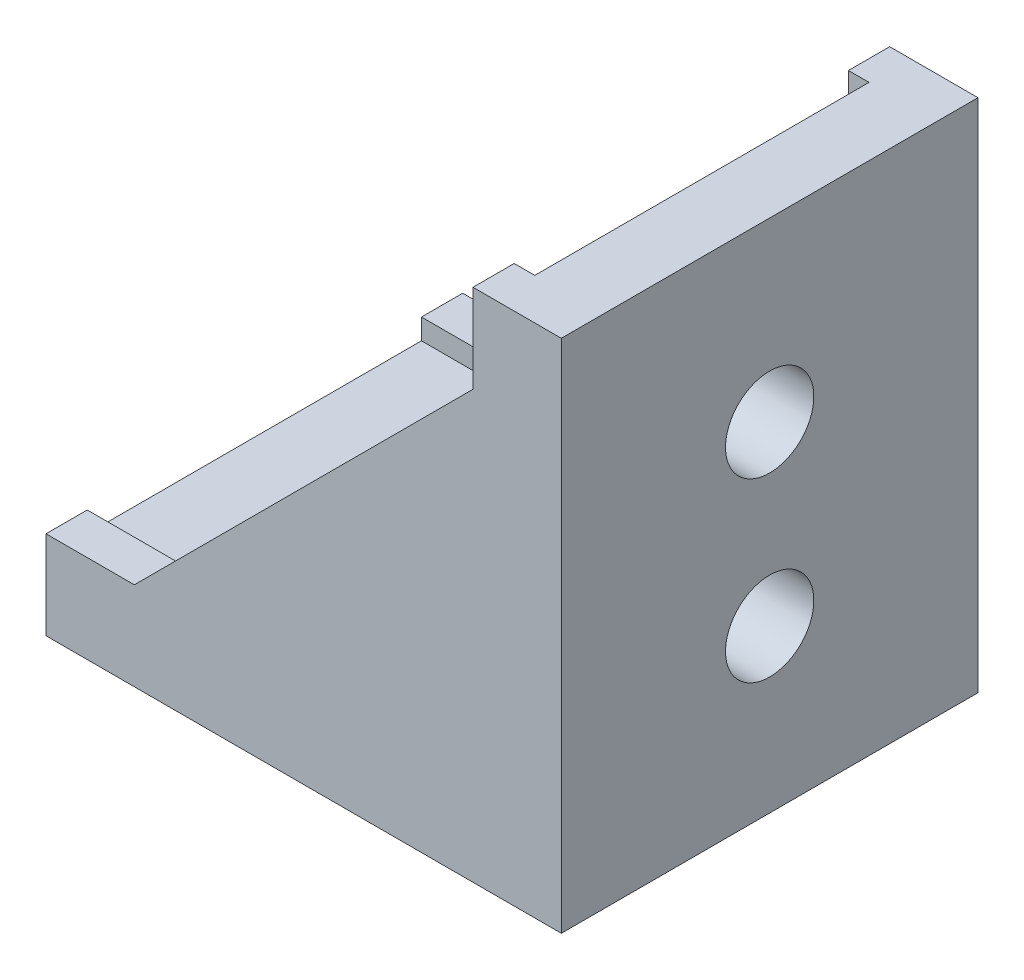
from build123d import *

# Parameters (mm, degrees)
EXTRUDE_1_DEPTH     = 14.15
SKETCH_2_W          = 30.4
SKETCH_2_H          = 30.4
CUT_EXTRUDE_1_DEPTH = 11.35
CUT_EXTRUDE_2_REACH = 53.48
SKETCH_4_R          = 3
CUT_EXTRUDE_3_REACH = 53.48
SKETCH_5_R          = 3


with BuildPart() as part:
    # 草图1 → 凸台-拉伸1 (new, symmetric)
    with BuildSketch(Plane.XY):
        Polygon((0, 0), (35, 0), (35, 35), (29, 35), (29, 29), (6, 6), (0, 6), align=None)
    extrude(amount=EXTRUDE_1_DEPTH, both=True)

    # 草图2 → 切除-拉伸1 (cut, symmetric)
    with BuildSketch(Plane.XY):
        with Locations((15.2, 19.8)):
            Rectangle(SKETCH_2_W, SKETCH_2_H)
    extrude(amount=CUT_EXTRUDE_1_DEPTH, both=True, mode=Mode.SUBTRACT)

    # 草图4 → 切除-拉伸2 (cut, up to next)
    with BuildSketch(Plane(origin=(0, 0, 0), x_dir=(1, 0, 0), z_dir=(0, 1, 0)), mode=Mode.PRIVATE) as cut_extrude_2_sk1:
        with Locations(Location((23, 0, 0), (0, 0, 270))):
            Circle(SKETCH_4_R)
    cut_extrude_2_tool1 = extrude(cut_extrude_2_sk1.sketch, amount=CUT_EXTRUDE_2_REACH, mode=Mode.PRIVATE) & part.part
    # 草图4 → 切除-拉伸2 (cut, up to next)
    with BuildSketch(Plane(origin=(0, 0, 0), x_dir=(1, 0, 0), z_dir=(0, 1, 0)), mode=Mode.PRIVATE) as cut_extrude_2_sk2:
        with Locations(Location((11, 0, 0), (0, 0, 270))):
            Circle(SKETCH_4_R)
    cut_extrude_2_tool2 = extrude(cut_extrude_2_sk2.sketch, amount=CUT_EXTRUDE_2_REACH, mode=Mode.PRIVATE) & part.part
    add(cut_extrude_2_tool1.solids().sort_by_distance((23, 0, 0))[0], mode=Mode.SUBTRACT)
    add(cut_extrude_2_tool2.solids().sort_by_distance((11, 0, 0))[0], mode=Mode.SUBTRACT)

    # 草图5 → 切除-拉伸3 (cut, up to next)
    with BuildSketch(Plane(origin=(0, 0, 0), x_dir=(0, 0, -1), z_dir=(1, 0, 0)), mode=Mode.PRIVATE) as cut_extrude_3_sk1:
        with Locations(Location((0, 23, 0), (0, 0, 180))):
            Circle(SKETCH_5_R)
    cut_extrude_3_tool1 = extrude(cut_extrude_3_sk1.sketch, amount=CUT_EXTRUDE_3_REACH, mode=Mode.PRIVATE) & part.part
    # 草图5 → 切除-拉伸3 (cut, up to next)
    with BuildSketch(Plane(origin=(0, 0, 0), x_dir=(0, 0, -1), z_dir=(1, 0, 0)), mode=Mode.PRIVATE) as cut_extrude_3_sk2:
        with Locations(Location((0, 11, 0), (0, 0, 180))):
            Circle(SKETCH_5_R)
    cut_extrude_3_tool2 = extrude(cut_extrude_3_sk2.sketch, amount=CUT_EXTRUDE_3_REACH, mode=Mode.PRIVATE) & part.part
    add(cut_extrude_3_tool1.solids().sort_by_distance((0, 23, 0))[0], mode=Mode.SUBTRACT)
    add(cut_extrude_3_tool2.solids().sort_by_distance((0, 11, 0))[0], mode=Mode.SUBTRACT)


solid = part.part
